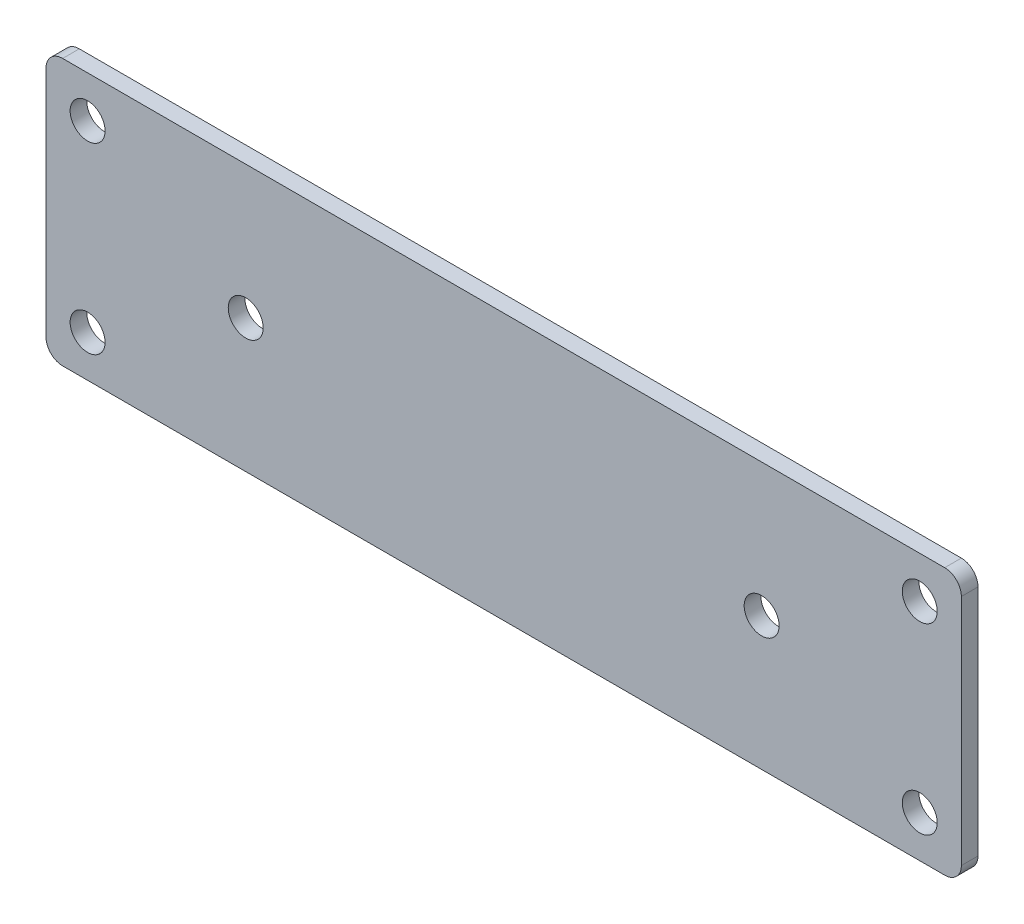
from build123d import *

# Parameters (mm, degrees)
SKETCH_1_W      = 110
SKETCH_1_H      = 32
SKETCH_1_R      = 2.1
EXTRUDE_1_DEPTH = 2
FILLET_1_R      = 2


with BuildPart() as part:
    # ｽｹｯﾁ1 → ﾎﾞｽ - 押し出し1 (new body)
    with BuildSketch(Plane.XY):
        Rectangle(SKETCH_1_W, SKETCH_1_H)
        with Locations((31, 0)):
            Circle(SKETCH_1_R, mode=Mode.SUBTRACT)
        with Locations(Location((-31, 0, 0), (0, 0, 180))):
            Circle(SKETCH_1_R, mode=Mode.SUBTRACT)
        with Locations((50, 11)):
            Circle(SKETCH_1_R, mode=Mode.SUBTRACT)
        with Locations(Location((-50, 11, 0), (0, 0, 180))):
            Circle(SKETCH_1_R, mode=Mode.SUBTRACT)
        with Locations((-50, -11)):
            Circle(SKETCH_1_R, mode=Mode.SUBTRACT)
        with Locations(Location((50, -11, 0), (0, 0, 180))):
            Circle(SKETCH_1_R, mode=Mode.SUBTRACT)
    extrude(amount=EXTRUDE_1_DEPTH)

    # ﾌｨﾚｯﾄ1
    fillet_1_edges = [part.edges().sort_by_distance(p)[0] for p in [
        (55, -16, 1),
        (-55, -16, 1),
        (-55, 16, 1),
        (55, 16, 1),
    ]]
    fillet(fillet_1_edges, radius=FILLET_1_R)


solid = part.part
